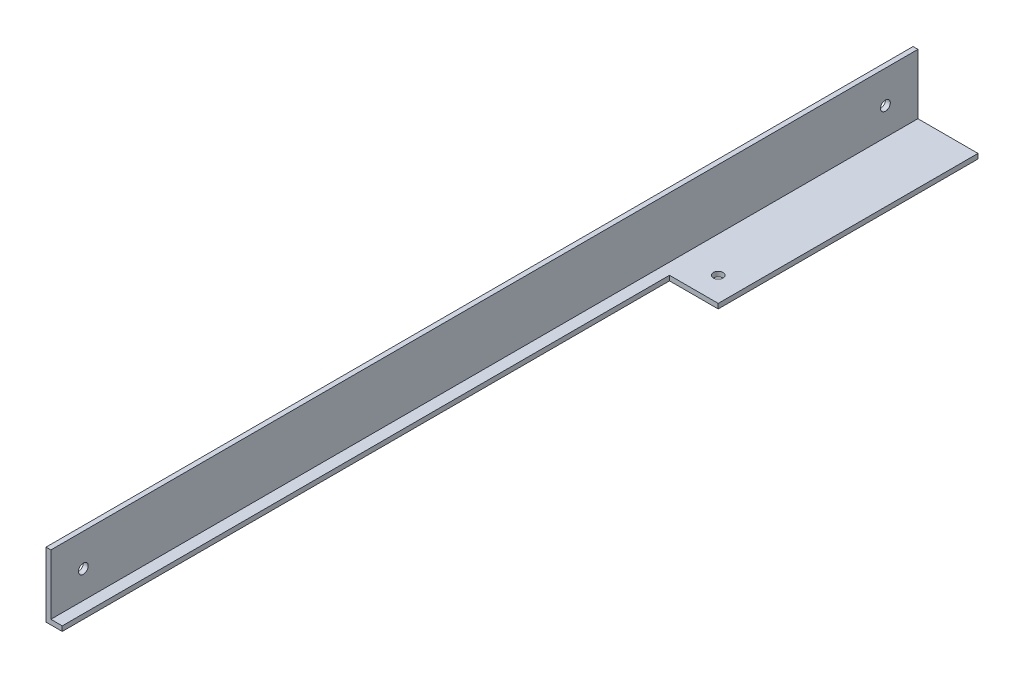
from build123d import *

# Parameters (mm, degrees)
EXTRUSION1_DEPTH = 267
ESQUISSE2_R      = 1.5
ESQUISSE2_W      = 15
ESQUISSE2_H      = 187
EXTRUSION2_DEPTH = 269.38638192
ESQUISSE3_R      = 1.5
EXTRUSION3_DEPTH = 264


with BuildPart() as part:
    # Esquisse1 → Extrusion1 (new body)
    with BuildSketch(Plane.XY):
        Polygon((0, 0), (20, 0), (20, 1.5), (1.5, 1.5), (1.5, 20), (0, 20), align=None)
    extrude(amount=EXTRUSION1_DEPTH)

    # Esquisse2 → Extrusion2 (cut, through all)
    with BuildSketch(Plane(origin=(0, 1.5, 0), x_dir=(1, 0, 0), z_dir=(0, 1, 0))):
        with Locations(Location((12.5, -72.5, 0), (0, 0, 180))):
            Circle(ESQUISSE2_R)
        with Locations((12.5, -173.5)):
            Rectangle(ESQUISSE2_W, ESQUISSE2_H)
    extrude(amount=-EXTRUSION2_DEPTH, mode=Mode.SUBTRACT)

    # Esquisse3 → Extrusion3 (cut)
    with BuildSketch(Plane(origin=(1.5, 0, 0), x_dir=(0, 0, -1), z_dir=(1, 0, 0))):
        with Locations(Location((-257, 10, 0), (0, 0, 90))):
            Circle(ESQUISSE3_R)
        with Locations(Location((-10, 10, 0), (0, 0, 90))):
            Circle(ESQUISSE3_R)
    extrude(amount=-EXTRUSION3_DEPTH, mode=Mode.SUBTRACT)


solid = part.part
